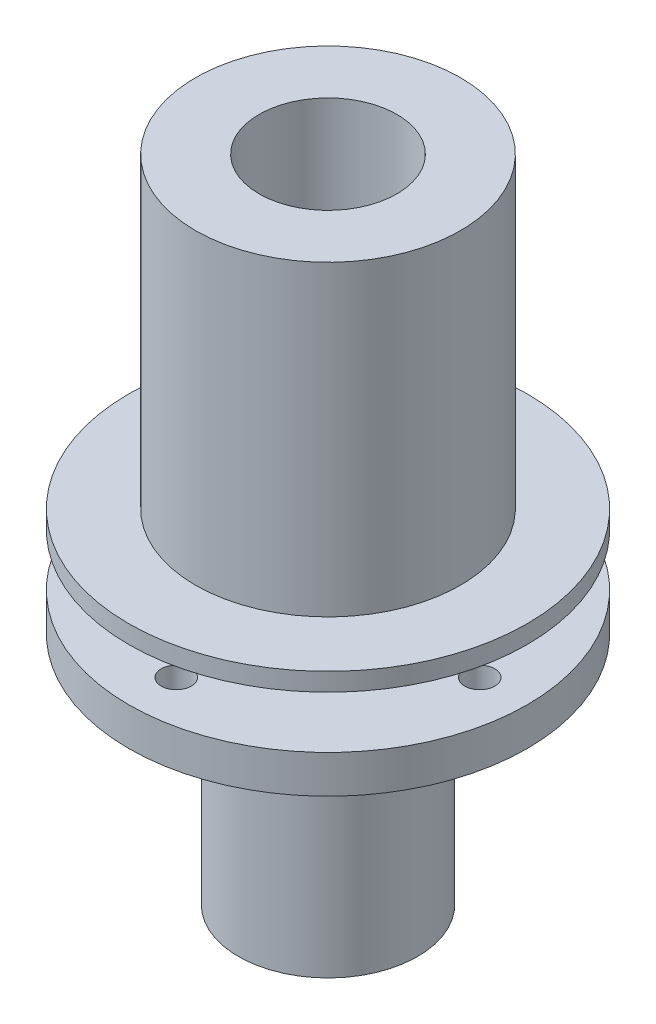
from build123d import *

# Parameters (mm, degrees)
MOUNTING_PLATE_SKETCH_R = 52.500000029
MOUNT_PLATE_DEPTH       = 10
HUB_RIM_SEAT_SKETCH_R   = 27.435
HUB_SEAT_DEPTH          = 7
SKETCH4_R               = 22.225
CENTERLOCK_SHAFT_DEPTH  = 7.287514
SKETCH7_R               = 25.4
BOSS_EXTRUDE5_DEPTH     = 13.74902
SKETCH6_R               = 52.500000029
SKETCH6_R_2             = 25.4
BOSS_EXTRUDE7_DEPTH     = 4.7625
SKETCH11_W              = 3.96875
SKETCH11_H              = 10
DRIVE_PINS_AT_2_COUNT   = 2
DRIVE_PINS_AT_2_PITCH   = 56.568542495
DRIVE_PINS_AT_3_COUNT   = 2
DRIVE_PINS_AT_3_PITCH   = 80
DRIVE_PINS_AT_4_COUNT   = 2
DRIVE_PINS_AT_4_PITCH   = 56.568542495
SKETCH12_R              = 34.925
SKETCH12_R_2            = 18.161
BOSS_EXTRUDE8_DEPTH     = 80.9625
SKETCH22_R              = 23.61946
BOSS_EXTRUDE9_DEPTH     = 47.625


with BuildPart() as part:
    # Mounting Plate SKETCH → Mount Plate (new body)
    with BuildSketch(Plane(origin=(0, 0, 0), x_dir=(1, 0, 0), z_dir=(0, 1, 0))):
        Circle(MOUNTING_PLATE_SKETCH_R)
    extrude(amount=MOUNT_PLATE_DEPTH)

    # Hub-Rim Seat SKETCH → Hub Seat (add)
    with BuildSketch(Plane.XZ):
        Circle(HUB_RIM_SEAT_SKETCH_R)
    extrude(amount=HUB_SEAT_DEPTH)

    # Sketch4 → Centerlock Shaft (add)
    with BuildSketch(Plane.XZ.offset(7)):
        Circle(SKETCH4_R)
    extrude(amount=CENTERLOCK_SHAFT_DEPTH)

    # Sketch7 → Boss-Extrude5 (add)
    with BuildSketch(Plane(origin=(0, 10, 0), x_dir=(1, 0, 0), z_dir=(0, 1, 0))):
        Circle(SKETCH7_R)
    extrude(amount=BOSS_EXTRUDE5_DEPTH)

    # Sketch11 → Drive Pins (revolve, cut)
    with BuildSketch(Plane(origin=(0, 0, 40), x_dir=(0, 0, -1), z_dir=(1, 0, 0))):
        with Locations((1.984375, 5)):
            Rectangle(SKETCH11_W, SKETCH11_H)
    drive_pins = revolve(axis=Axis((0, -6.35, 40), (0, 1, 0)), mode=Mode.SUBTRACT)

    # Drive Pins at 2: Drive Pins ×2
    with Locations(*[Vector(-0.7071067811865475, 0, -0.7071067811865477) * (i * DRIVE_PINS_AT_2_PITCH) for i in range(1, DRIVE_PINS_AT_2_COUNT)]):
        add(drive_pins, mode=Mode.SUBTRACT)

    # Drive Pins at 3: Drive Pins ×2
    with Locations(*[(0, 0, -i * DRIVE_PINS_AT_3_PITCH) for i in range(1, DRIVE_PINS_AT_3_COUNT)]):
        add(drive_pins, mode=Mode.SUBTRACT)

    # Drive Pins at 4: Drive Pins ×2
    with Locations(*[Vector(0.7071067811865476, 0, -0.7071067811865475) * (i * DRIVE_PINS_AT_4_PITCH) for i in range(1, DRIVE_PINS_AT_4_COUNT)]):
        add(drive_pins, mode=Mode.SUBTRACT)

    # Sketch22 → Boss-Extrude9 (add)
    with BuildSketch(Plane.XZ.offset(14.287514)):
        Circle(SKETCH22_R)
    extrude(amount=BOSS_EXTRUDE9_DEPTH)


with BuildPart() as body_2:
    # Sketch6 → Boss-Extrude7 (new body)
    with BuildSketch(Plane(origin=(0, 23.74902, 0), x_dir=(1, 0, 0), z_dir=(0, 1, 0))):
        Circle(SKETCH6_R)
        Circle(SKETCH6_R_2, mode=Mode.SUBTRACT)
    extrude(amount=BOSS_EXTRUDE7_DEPTH)


with BuildPart() as body_3:
    # Sketch12 → Boss-Extrude8 (new body)
    with BuildSketch(Plane(origin=(0, 28.51152, 0), x_dir=(1, 0, 0), z_dir=(0, 1, 0))):
        Circle(SKETCH12_R)
        Circle(SKETCH12_R_2, mode=Mode.SUBTRACT)
    extrude(amount=BOSS_EXTRUDE8_DEPTH)


solid = Compound([part.part, body_2.part, body_3.part])
